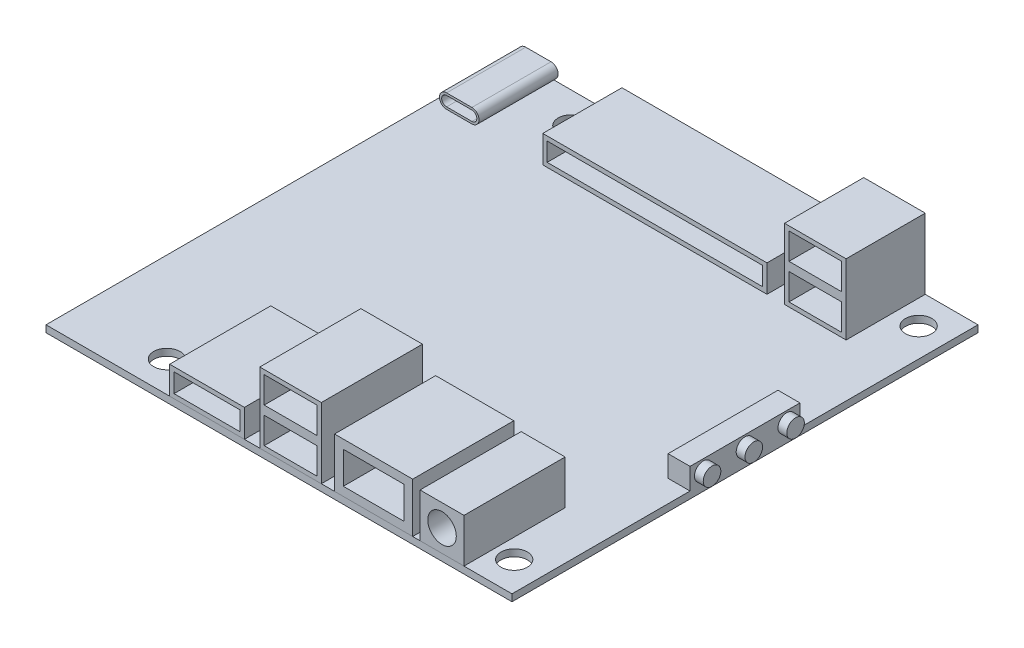
from build123d import *

# Parameters (mm, degrees)
SKETCH1_W             = 106
SKETCH1_H             = 106
SKETCH1_R             = 3
BOSS_EXTRUDE1_DEPTH   = 1.57
SKETCH2_W             = 17
SKETCH2_H             = 6.3
SKETCH2_W_2           = 15
SKETCH2_H_2           = 4.3
BOSS_EXTRUDE2_DEPTH   = 23
SKETCH2_W_3           = 10
SKETCH2_H_3           = 10
SKETCH2_R             = 3.25
BOSS_EXTRUDE2_2_DEPTH = 23
SKETCH2_W_4           = 17.78
SKETCH2_H_4           = 11.3
SKETCH2_W_5           = 13.78
SKETCH2_H_5           = 7.3
BOSS_EXTRUDE2_3_DEPTH = 23
SKETCH2_W_6           = 14
SKETCH2_H_6           = 16
SKETCH2_W_7           = 12
SKETCH2_H_7           = 6
BOSS_EXTRUDE2_4_DEPTH = 23
SKETCH3_W             = 14
SKETCH3_H             = 16
SKETCH3_W_2           = 12
SKETCH3_H_2           = 6
BOSS_EXTRUDE3_DEPTH   = 18
BOSS_EXTRUDE3_2_DEPTH = 18
SKETCH3_W_3           = 51
SKETCH3_H_3           = 6.2
SKETCH3_W_4           = 49
SKETCH3_H_4           = 4.2
BOSS_EXTRUDE3_3_DEPTH = 18
SKETCH4_W             = 25
SKETCH4_H             = 4.86
BOSS_EXTRUDE4_DEPTH   = 5
SKETCH4_3_R           = 2
BOSS_EXTRUDE5_DEPTH   = 2


with BuildPart() as part:
    # Sketch1 → Boss-Extrude1 (new body)
    with BuildSketch(Plane(origin=(0, 0, 0), x_dir=(1, 0, 0), z_dir=(0, 1, 0))):
        Rectangle(SKETCH1_W, SKETCH1_H)
        with Locations((46.5, -46)):
            Circle(SKETCH1_R, mode=Mode.SUBTRACT)
        with Locations((-32.5, -46)):
            Circle(SKETCH1_R, mode=Mode.SUBTRACT)
        with Locations((-32.5, 46)):
            Circle(SKETCH1_R, mode=Mode.SUBTRACT)
        with Locations((46.5, 46)):
            Circle(SKETCH1_R, mode=Mode.SUBTRACT)
    extrude(amount=BOSS_EXTRUDE1_DEPTH)

    # Sketch4 → Boss-Extrude4 (add)
    with BuildSketch(Plane(origin=(53, 0, 0), x_dir=(0, 0, -1), z_dir=(1, 0, 0))):
        with Locations((0, 4)):
            Rectangle(SKETCH4_W, SKETCH4_H)
    extrude(amount=-BOSS_EXTRUDE4_DEPTH)

    # Sketch4<3> → Boss-Extrude5 (add)
    with BuildSketch(Plane(origin=(53, 0, 0), x_dir=(0, 0, -1), z_dir=(1, 0, 0))):
        with Locations((-9.5, 4)):
            Circle(SKETCH4_3_R)
        with Locations((0, 4)):
            Circle(SKETCH4_3_R)
        with Locations((9.5, 4)):
            Circle(SKETCH4_3_R)
    extrude(amount=BOSS_EXTRUDE5_DEPTH)


with BuildPart() as body_2:
    # Sketch2 → Boss-Extrude2 (new body)
    with BuildSketch(Plane.XY.offset(53)):
        with Locations((-16.37, 4.72)):
            Rectangle(SKETCH2_W, SKETCH2_H)
        with Locations((-16.37, 4.72)):
            Rectangle(SKETCH2_W_2, SKETCH2_H_2, mode=Mode.SUBTRACT)
    extrude(amount=-BOSS_EXTRUDE2_DEPTH)


with BuildPart() as body_3:
    # Sketch2 → Boss-Extrude2 2 (new body)
    with BuildSketch(Plane.XY.offset(53)):
        with Locations((37.08, 6.57)):
            Rectangle(SKETCH2_W_3, SKETCH2_H_3)
        with Locations((37.08, 6.57)):
            Circle(SKETCH2_R, mode=Mode.SUBTRACT)
    extrude(amount=-BOSS_EXTRUDE2_2_DEPTH)


with BuildPart() as body_4:
    # Sketch2 → Boss-Extrude2 3 (new body)
    with BuildSketch(Plane.XY.offset(53)):
        with Locations((21.52, 7.22)):
            Rectangle(SKETCH2_W_4, SKETCH2_H_4)
        with Locations((21.52, 7.22)):
            Rectangle(SKETCH2_W_5, SKETCH2_H_5, mode=Mode.SUBTRACT)
    extrude(amount=-BOSS_EXTRUDE2_3_DEPTH)


with BuildPart() as body_5:
    # Sketch2 → Boss-Extrude2 4 (new body)
    with BuildSketch(Plane.XY.offset(53)):
        with Locations((2.63, 9.57)):
            Rectangle(SKETCH2_W_6, SKETCH2_H_6)
        with Locations((2.63, 5.57)):
            Rectangle(SKETCH2_W_7, SKETCH2_H_7, mode=Mode.SUBTRACT)
        with Locations((2.63, 13.57)):
            Rectangle(SKETCH2_W_7, SKETCH2_H_7, mode=Mode.SUBTRACT)
    extrude(amount=-BOSS_EXTRUDE2_4_DEPTH)


with BuildPart() as body_6:
    # Sketch3 → Boss-Extrude3 (new body)
    with BuildSketch(Plane(origin=(0, 0, -53), x_dir=(-1, 0, 0), z_dir=(0, 0, -1))):
        with Locations((-34, 9.57)):
            Rectangle(SKETCH3_W, SKETCH3_H)
        with Locations((-34, 5.57)):
            Rectangle(SKETCH3_W_2, SKETCH3_H_2, mode=Mode.SUBTRACT)
        with Locations((-34, 13.57)):
            Rectangle(SKETCH3_W_2, SKETCH3_H_2, mode=Mode.SUBTRACT)
    extrude(amount=-BOSS_EXTRUDE3_DEPTH)


with BuildPart() as body_7:
    # Sketch3 → Boss-Extrude3 2 (new body)
    with BuildSketch(Plane(origin=(0, 0, -53), x_dir=(-1, 0, 0), z_dir=(0, 0, -1))):
        with BuildLine():
            ThreePointArc((44.125, 4.82), (42.5, 3.195), (44.125, 1.57))
            Line((44.125, 1.57), (49.875, 1.57))
            ThreePointArc((49.875, 1.57), (51.5, 3.195), (49.875, 4.82))
            Line((49.875, 4.82), (44.125, 4.82))
        make_face()
        with BuildLine():
            ThreePointArc((44.125, 2.07), (43, 3.195), (44.125, 4.32))
            Line((44.125, 4.32), (49.875, 4.32))
            ThreePointArc((49.875, 4.32), (51, 3.195), (49.875, 2.07))
            Line((49.875, 2.07), (44.125, 2.07))
        make_face(mode=Mode.SUBTRACT)
    extrude(amount=-BOSS_EXTRUDE3_2_DEPTH)


with BuildPart() as body_8:
    # Sketch3 → Boss-Extrude3 3 (new body)
    with BuildSketch(Plane(origin=(0, 0, -53), x_dir=(-1, 0, 0), z_dir=(0, 0, -1))):
        with Locations((2.5, 4.67)):
            Rectangle(SKETCH3_W_3, SKETCH3_H_3)
        with Locations((2.5, 4.67)):
            Rectangle(SKETCH3_W_4, SKETCH3_H_4, mode=Mode.SUBTRACT)
    extrude(amount=-BOSS_EXTRUDE3_3_DEPTH)


solid = Compound([part.part, body_2.part, body_3.part, body_4.part, body_5.part, body_6.part, body_7.part, body_8.part])
